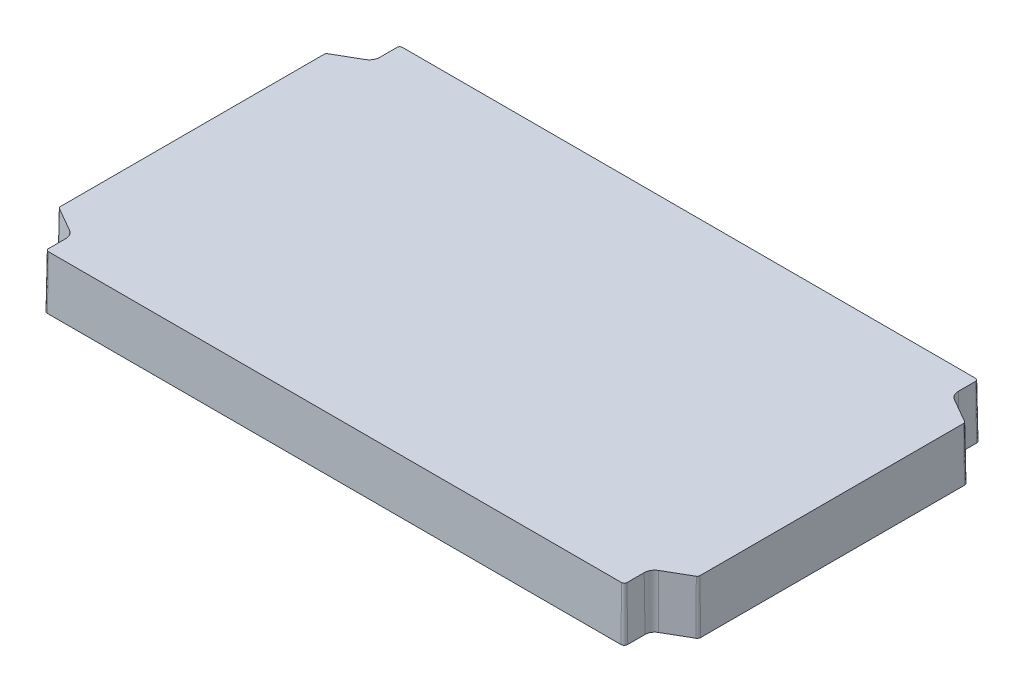
from build123d import *

# Parameters (mm, degrees)
BOSS_EXTRUDE1_DEPTH = 25
BOSS_EXTRUDE1_DRAFT = 1


with BuildPart() as part:
    # Sketch1 → Boss-Extrude1 (with draft: the straight prism first)
    with BuildSketch(Plane(origin=(0, -37.552068535, 0), x_dir=(1, 0, 0), z_dir=(0, 1, 0))):
        with BuildLine():
            ThreePointArc((150.559794425, 62.112181192), (150.39707932, 62.719442231), (149.952533386, 63.163988165))
            Line((149.952533386, 63.163988165), (138.703010202, 69.658903404))
            ThreePointArc((138.703010202, 69.658903404), (136.878930836, 71.482982769), (136.21127145, 73.97472152))
            Line((136.21127145, 73.97472152), (136.21127145, 82.121264476))
            ThreePointArc((136.21127145, 82.121264476), (135.855546169, 82.980061273), (134.996749372, 83.335786554))
            Line((134.996749372, 83.335786554), (-134.996749372, 83.335786554))
            ThreePointArc((-134.996749372, 83.335786554), (-135.855546169, 82.980061273), (-136.21127145, 82.121264476))
            Line((-136.21127145, 82.121264476), (-136.21127145, 73.97472152))
            ThreePointArc((-136.21127145, 73.97472152), (-136.878930836, 71.482982769), (-138.703010202, 69.658903404))
            Line((-138.703010202, 69.658903404), (-149.952533386, 63.163988165))
            ThreePointArc((-149.952533386, 63.163988165), (-150.39707932, 62.719442231), (-150.559794425, 62.112181192))
            Line((-150.559794425, 62.112181192), (-150.559794425, -62.112181192))
            ThreePointArc((-150.559794425, -62.112181192), (-150.39707932, -62.719442231), (-149.952533386, -63.163988165))
            Line((-149.952533386, -63.163988165), (-138.703010202, -69.658903404))
            ThreePointArc((-138.703010202, -69.658903404), (-136.878930836, -71.482982769), (-136.21127145, -73.97472152))
            Line((-136.21127145, -73.97472152), (-136.21127145, -82.121264476))
            ThreePointArc((-136.21127145, -82.121264476), (-135.855546169, -82.980061273), (-134.996749372, -83.335786554))
            Line((-134.996749372, -83.335786554), (134.996749372, -83.335786554))
            ThreePointArc((134.996749372, -83.335786554), (135.855546169, -82.980061273), (136.21127145, -82.121264476))
            Line((136.21127145, -82.121264476), (136.21127145, -73.97472152))
            ThreePointArc((136.21127145, -73.97472152), (136.878930836, -71.482982769), (138.703010202, -69.658903404))
            Line((138.703010202, -69.658903404), (149.952533386, -63.163988165))
            ThreePointArc((149.952533386, -63.163988165), (150.39707932, -62.719442231), (150.559794425, -62.112181192))
            Line((150.559794425, -62.112181192), (150.559794425, 62.112181192))
        make_face()
    extrude(amount=-BOSS_EXTRUDE1_DEPTH)
    # Boss-Extrude1: the draft: its side faces are tilted about the plane it starts from
    boss_extrude1_sides = [part.faces().sort_by_distance(p)[0] for p in [
        (150.39707932, -50.052068535, -62.719442231),
        (144.327771794, -50.052068535, -66.411445784),
        (136.878930836, -50.052068535, -71.482982769),
        (136.21127145, -50.052068535, -78.047992998),
        (135.855546169, -50.052068535, -82.980061273),
        (0, -50.052068535, -83.335786554),
        (-135.855546169, -50.052068535, -82.980061273),
        (-136.21127145, -50.052068535, -78.047992998),
        (-136.878930836, -50.052068535, -71.482982769),
        (-144.327771794, -50.052068535, -66.411445784),
        (-150.39707932, -50.052068535, -62.719442231),
        (-150.559794425, -50.052068535, 0),
        (-150.39707932, -50.052068535, 62.719442231),
        (-144.327771794, -50.052068535, 66.411445784),
        (-136.878930836, -50.052068535, 71.482982769),
        (-136.21127145, -50.052068535, 78.047992998),
        (-135.855546169, -50.052068535, 82.980061273),
        (0, -50.052068535, 83.335786554),
        (135.855546169, -50.052068535, 82.980061273),
        (136.21127145, -50.052068535, 78.047992998),
        (136.878930836, -50.052068535, 71.482982769),
        (144.327771794, -50.052068535, 66.411445784),
        (150.39707932, -50.052068535, 62.719442231),
        (150.559794425, -50.052068535, 0),
    ]]
    draft(boss_extrude1_sides, Plane(origin=(0, -37.552068535, 0), x_dir=(1, 0, 0), z_dir=(0, 1, 0)), BOSS_EXTRUDE1_DRAFT)


solid = part.part
